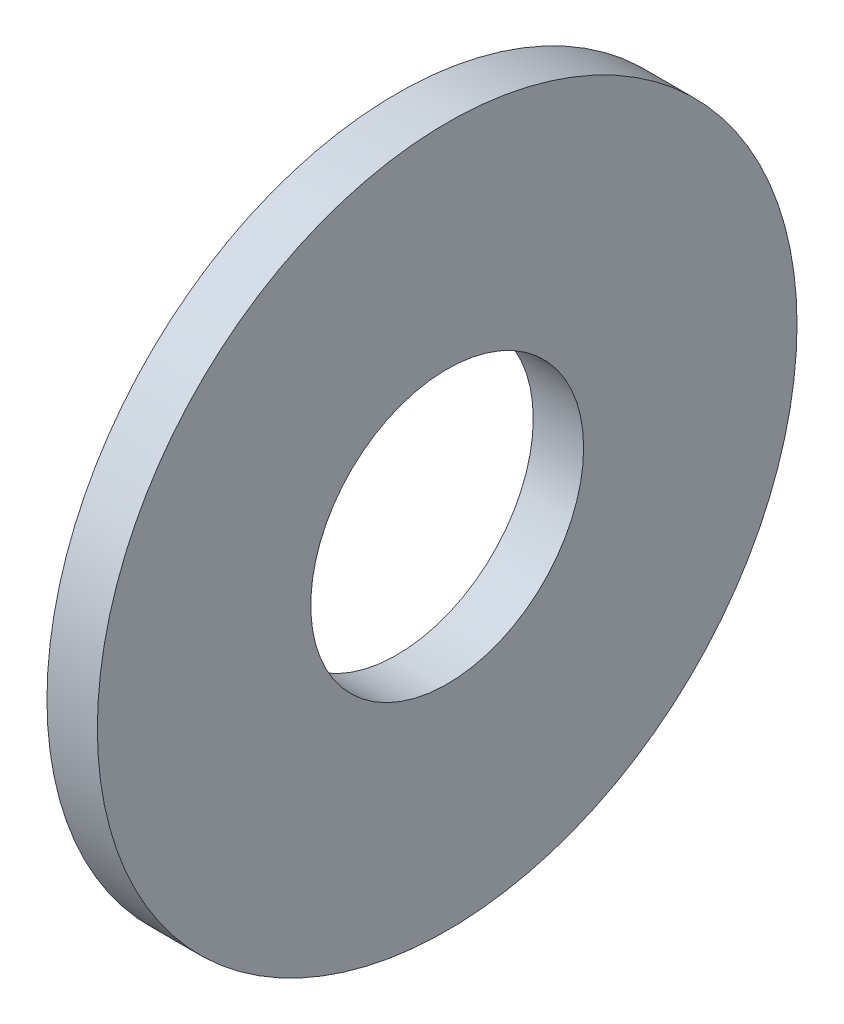
from build123d import *

# Parameters (mm, degrees)
SKETCH3_R           = 12.7
SKETCH3_R_2         = 4.953
BOSS_EXTRUDE1_DEPTH = 0.9144


with BuildPart() as part:
    # Sketch3 → Boss-Extrude1 (new, symmetric)
    with BuildSketch(Plane(origin=(0, 0, 0), x_dir=(0, 0, -1), z_dir=(1, 0, 0))):
        Circle(SKETCH3_R)
        Circle(SKETCH3_R_2, mode=Mode.SUBTRACT)
    extrude(amount=BOSS_EXTRUDE1_DEPTH, both=True)


solid = part.part
